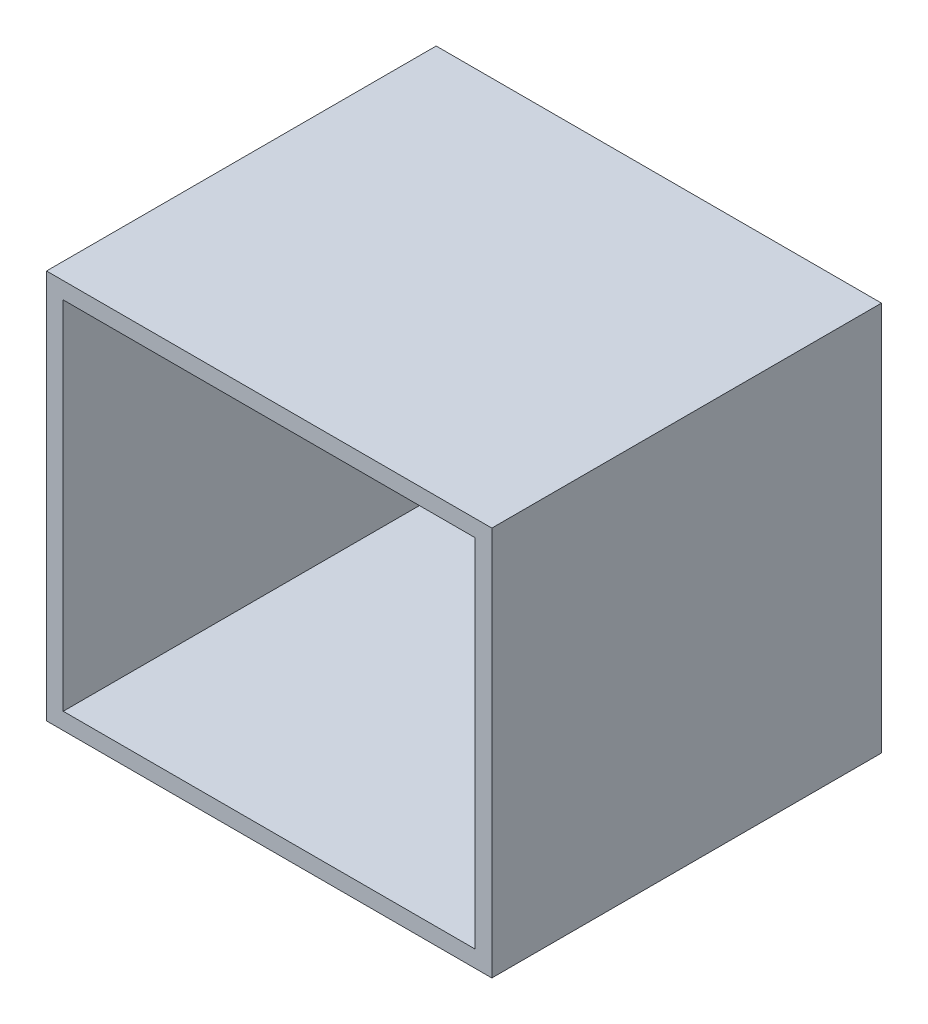
from build123d import *

# Parameters (mm, degrees)
SKETCH1_W           = 400
SKETCH1_H           = 350
SKETCH1_W_2         = 370
SKETCH1_H_2         = 320
BOSS_EXTRUDE1_DEPTH = 350


with BuildPart() as part:
    # Sketch1 → Boss-Extrude1 (new body)
    with BuildSketch(Plane.XY):
        with Locations((200, 0)):
            Rectangle(SKETCH1_W, SKETCH1_H)
        with Locations((200, 0)):
            Rectangle(SKETCH1_W_2, SKETCH1_H_2, mode=Mode.SUBTRACT)
    extrude(amount=BOSS_EXTRUDE1_DEPTH)


solid = part.part
